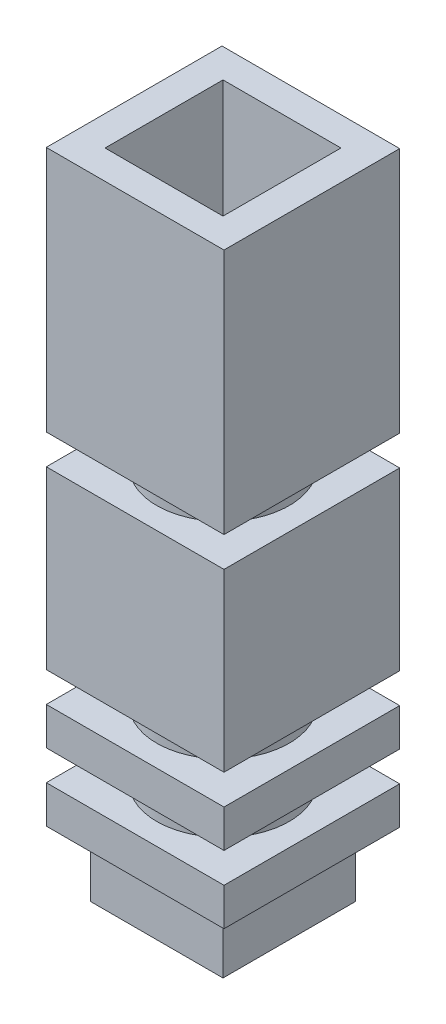
from build123d import *

# Parameters (mm, degrees)
BOSS_EXTRUDE1_DEPTH = 4.445
SKETCH1_4_W         = 3.3528
SKETCH1_4_H         = 1.524
BOSS_EXTRUDE2_DEPTH = 4.445
SKETCH1_6_W         = 3.3528
SKETCH1_6_H         = 1.524
BOSS_EXTRUDE3_DEPTH = 4.445
SKETCH1_8_W         = 3.3528
SKETCH1_8_H         = 1.524
BOSS_EXTRUDE4_DEPTH = 4.445
SKETCH1_10_W        = 6.7056
SKETCH1_10_H        = 3.2766
BOSS_EXTRUDE5_DEPTH = 3.3528
SKETCH2_W           = 5.969
SKETCH2_H           = 5.969
CUT_EXTRUDE1_DEPTH  = 11.0109
CUT_EXTRUDE2_REACH  = 35.62
SKETCH3_R           = 2.0574


with BuildPart() as part:
    # Sketch1 → Boss-Extrude1 (new, symmetric)
    with BuildSketch(Plane.XY):
        Polygon((0, 5.1816), (-3.3528, 5.1816), (-4.4958, 5.1816), (-4.4958, 3.2766), (-3.3528, 3.2766), (3.3528, 3.2766), (4.4958, 3.2766), (4.4958, 5.1816), (3.3528, 5.1816), align=None)
    extrude(amount=BOSS_EXTRUDE1_DEPTH, both=True)

    # Sketch1<4> → Revolve1 (revolve)
    with BuildSketch(Plane.XY):
        with Locations((-1.6764, 5.9436)):
            Rectangle(SKETCH1_4_W, SKETCH1_4_H)
    revolve(axis=Axis((0, 6.7056, 0), (0, -1, 0)))

    # Sketch1<5> → Boss-Extrude2 (add, symmetric)
    with BuildSketch(Plane.XY):
        Polygon((0, 8.6106), (-3.3528, 8.6106), (-4.4958, 8.6106), (-4.4958, 6.7056), (-3.3528, 6.7056), (0, 6.7056), (3.3528, 6.7056), (4.4958, 6.7056), (4.4958, 8.6106), (3.3528, 8.6106), align=None)
    extrude(amount=BOSS_EXTRUDE2_DEPTH, both=True)

    # Sketch1<6> → Revolve2 (revolve)
    with BuildSketch(Plane.XY):
        with Locations((-1.6764, 9.3726)):
            Rectangle(SKETCH1_6_W, SKETCH1_6_H)
    revolve(axis=Axis((0, 10.1346, 0), (0, -1, 0)))

    # Sketch1<7> → Boss-Extrude3 (add, symmetric)
    with BuildSketch(Plane.XY):
        Polygon((-3.3528, 19.0246), (-4.4958, 19.0246), (-4.4958, 10.1346), (-3.3528, 10.1346), (0, 10.1346), (3.3528, 10.1346), (4.4958, 10.1346), (4.4958, 19.0246), (3.3528, 19.0246), (0, 19.0246), align=None)
    extrude(amount=BOSS_EXTRUDE3_DEPTH, both=True)

    # Sketch1<8> → Revolve3 (revolve)
    with BuildSketch(Plane.XY):
        with Locations((-1.6764, 19.7866)):
            Rectangle(SKETCH1_8_W, SKETCH1_8_H)
    revolve(axis=Axis((0, 20.5486, 0), (0, -1, 0)))

    # Sketch1<9> → Boss-Extrude4 (add, symmetric)
    with BuildSketch(Plane.XY):
        Polygon((-4.4958, 20.5486), (-3.3528, 20.5486), (0, 20.5486), (3.3528, 20.5486), (4.4958, 20.5486), (4.4958, 33.02), (-4.4958, 33.02), align=None)
    extrude(amount=BOSS_EXTRUDE4_DEPTH, both=True)

    # Sketch1<10> → Boss-Extrude5 (add, symmetric)
    with BuildSketch(Plane.XY):
        with Locations((0, 1.6383)):
            Rectangle(SKETCH1_10_W, SKETCH1_10_H)
    extrude(amount=BOSS_EXTRUDE5_DEPTH, both=True)

    # Sketch2 → Cut-Extrude1 (cut)
    with BuildSketch(Plane(origin=(0, 33.02, 0), x_dir=(1, 0, 0), z_dir=(0, 1, 0))):
        Rectangle(SKETCH2_W, SKETCH2_H)
    extrude(amount=-CUT_EXTRUDE1_DEPTH, mode=Mode.SUBTRACT)

    # Sketch3 → Cut-Extrude2 (cut, up to next)
    with BuildSketch(Plane(origin=(0, 0, 0), x_dir=(-1, 0, 0), z_dir=(0, -1, 0)), mode=Mode.PRIVATE) as cut_extrude2_sk1:
        Circle(SKETCH3_R)
    cut_extrude2_tool1 = extrude(cut_extrude2_sk1.sketch, amount=-CUT_EXTRUDE2_REACH, mode=Mode.PRIVATE) & part.part
    add(cut_extrude2_tool1.solids().sort_by_distance((0, 0, 0))[0], mode=Mode.SUBTRACT)


solid = part.part
